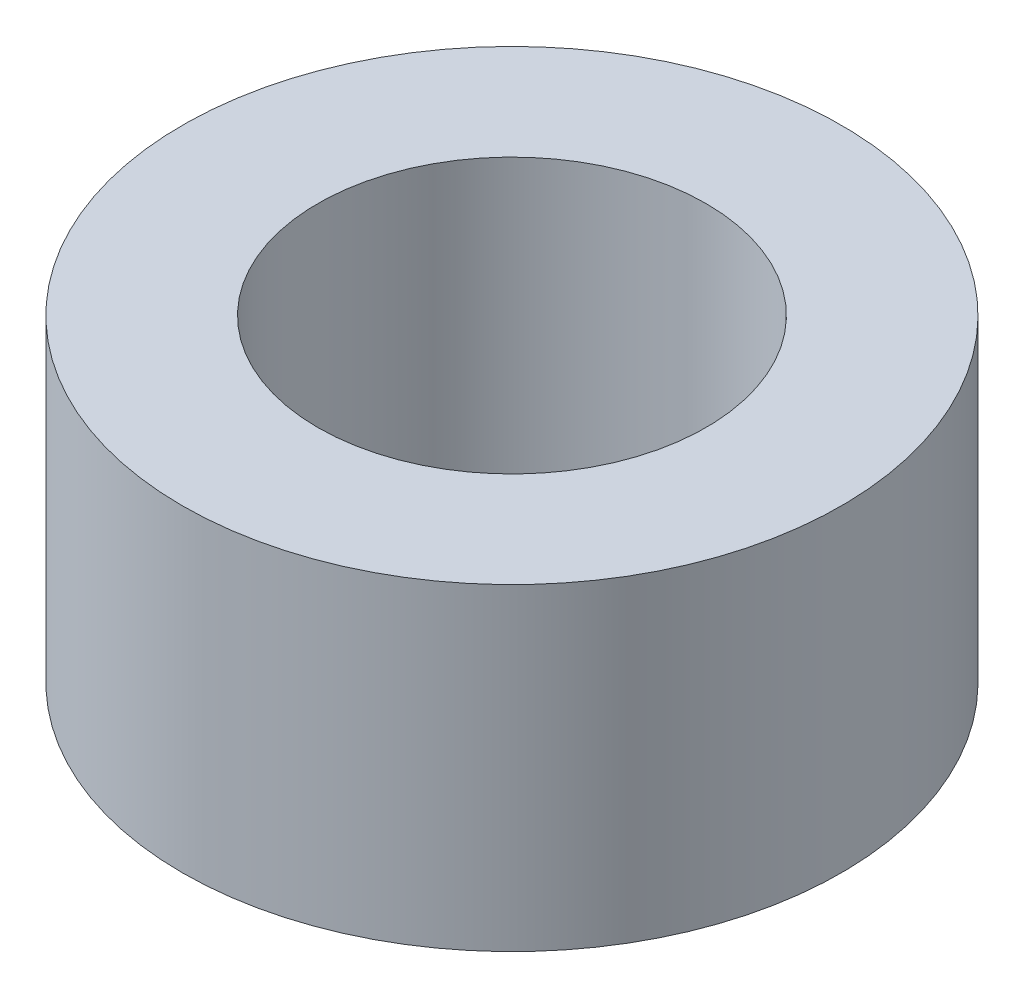
from build123d import *

# Parameters (mm, degrees)
SKETCH1_R           = 5.715
SKETCH1_R_2         = 3.3655
BOSS_EXTRUDE1_DEPTH = 5.5118


with BuildPart() as part:
    # Sketch1 → Boss-Extrude1 (new body)
    with BuildSketch(Plane(origin=(0, 0, 0), x_dir=(1, 0, 0), z_dir=(0, 1, 0))):
        with Locations(Location((0, 0, 0), (0, 0, 270))):
            Circle(SKETCH1_R)
        with Locations(Location((0, 0, 0), (0, 0, 270))):
            Circle(SKETCH1_R_2, mode=Mode.SUBTRACT)
    extrude(amount=BOSS_EXTRUDE1_DEPTH)


solid = part.part
